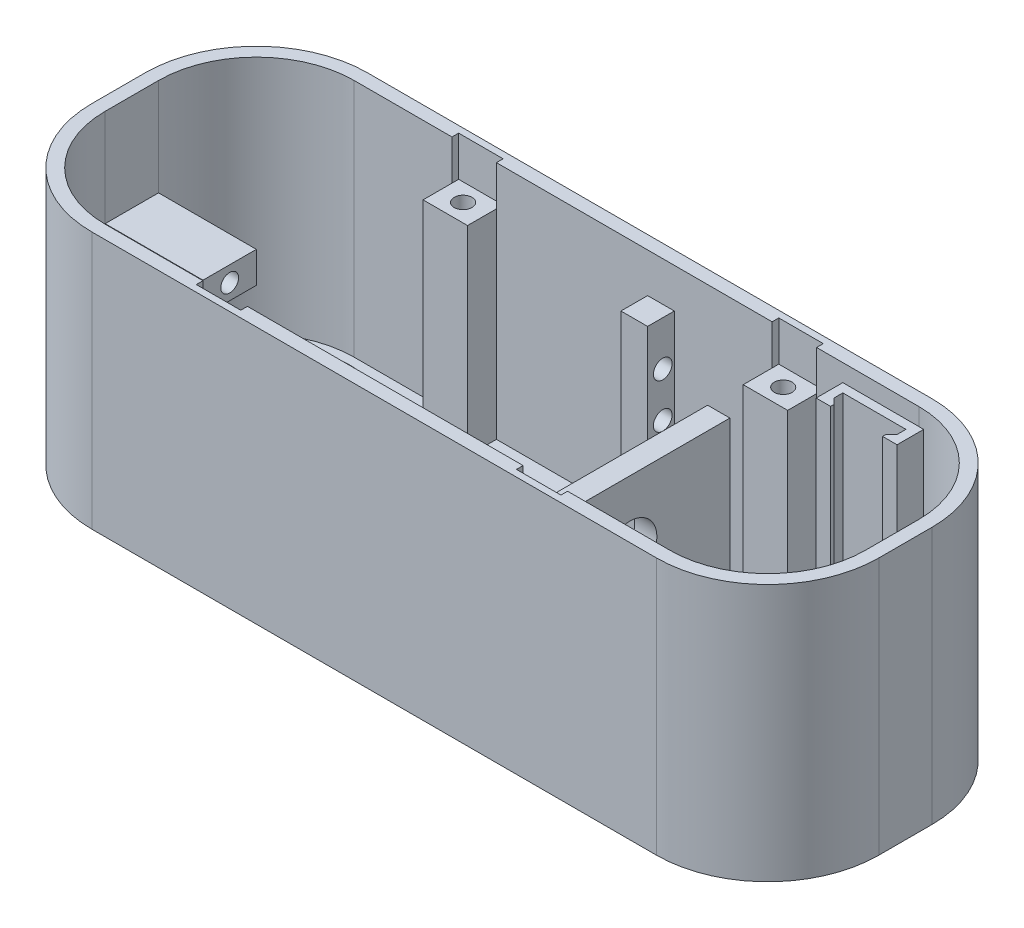
from build123d import *

# Parameters (mm, degrees)
SKETCH1_W            = 177
SKETCH1_H            = 62
BOSS_EXTRUDE1_DEPTH  = 60
FILLET1_R            = 25
SKETCH3_W            = 19
SKETCH3_H            = 17
CUT_EXTRUDE1_DEPTH   = 70
CUT_EXTRUDE5_DEPTH   = 54
SKETCH2_R            = 22
BOSS_EXTRUDE4_DEPTH  = 7
BOSS_EXTRUDE6_DEPTH  = 53
SKETCH11_R           = 20
CUT_EXTRUDE9_DEPTH   = 3.5
SKETCH21_R           = 25
CUT_EXTRUDE10_DEPTH  = 18
SKETCH23_R           = 5
CUT_EXTRUDE11_DEPTH  = 111
SKETCH26_R           = 20
SKETCH26_W           = 19
SKETCH26_H           = 17
BOSS_EXTRUDE23_DEPTH = 1
SKETCH27_W           = 30
SKETCH27_H           = 8
CUT_EXTRUDE12_DEPTH  = 10
SKETCH30_W           = 194.337314874
SKETCH30_H           = 68.122542634
CUT_EXTRUDE14_DEPTH  = 0.1
SKETCH32_R           = 2
CUT_EXTRUDE15_DEPTH  = 20
SKETCH35_W           = 193.893814344
SKETCH35_H           = 68.847857072
CUT_EXTRUDE16_DEPTH  = 3
SKETCH38_W           = 10
SKETCH38_H           = 6.5
SKETCH38_R           = 2
SKETCH38_H_2         = 1.5
BOSS_EXTRUDE26_DEPTH = 53.9
SKETCH39_R           = 2
CUT_EXTRUDE17_DEPTH  = 20
SKETCH38_4_W         = 10
SKETCH38_4_H         = 8
SKETCH38_4_R         = 2
CUT_EXTRUDE22_DEPTH  = 9
SKETCH39_4_W         = 12
SKETCH39_4_H         = 7.011037151
SKETCH39_4_R         = 2
SKETCH39_4_H_2       = 6.988962849
BOSS_EXTRUDE27_DEPTH = 25
SKETCH40_W           = 5
SKETCH40_H           = 35
BOSS_EXTRUDE28_DEPTH = 44.9
CUT_EXTRUDE23_REACH  = 147.748
SKETCH41_R           = 6.075
BOSS_EXTRUDE29_REACH = 193.14
SKETCH44_W           = 6
SKETCH44_H           = 6
SKETCH44_H_2         = 8
BOSS_EXTRUDE30_DEPTH = 45
SKETCH45_R           = 2.1
CUT_EXTRUDE24_DEPTH  = 15
SKETCH46_W           = 20
SKETCH46_H           = 7
CUT_EXTRUDE25_DEPTH  = 10
SKETCH47_W           = 10
SKETCH47_H           = 20
CUT_EXTRUDE26_DEPTH  = 10


with BuildPart() as part:
    # Sketch1 → Boss-Extrude1 (new body)
    with BuildSketch(Plane(origin=(0, 0, 0), x_dir=(1, 0, 0), z_dir=(0, 1, 0))):
        with Locations((88.5, 31)):
            Rectangle(SKETCH1_W, SKETCH1_H)
    extrude(amount=BOSS_EXTRUDE1_DEPTH)

    # Fillet1
    fillet1_edges = [part.edges().sort_by_distance(p)[0] for p in [
        (0, 30, -62),
        (177, 30, -62),
        (177, 30, 0),
        (0, 30, 0),
    ]]
    fillet(fillet1_edges, radius=FILLET1_R)

    # Sketch3 → Cut-Extrude1 (cut)
    with BuildSketch(Plane(origin=(0, 60, 0), x_dir=(1, 0, 0), z_dir=(0, 1, 0))):
        with Locations((147.5, 39.5)):
            Rectangle(SKETCH3_W, SKETCH3_H)
    extrude(amount=-CUT_EXTRUDE1_DEPTH, mode=Mode.SUBTRACT)

    # Sketch9 → Cut-Extrude5 (cut)
    with BuildSketch(Plane(origin=(0, 57, 0), x_dir=(1, 0, 0), z_dir=(0, 1, 0))):
        with BuildLine():
            Line((25, 59), (152, 59))
            ThreePointArc((152, 59), (167.556349186, 52.556349186), (174, 37))
            Line((174, 37), (174, 25))
            ThreePointArc((174, 25), (167.556349186, 9.443650814), (152, 3))
            Line((152, 3), (25, 3))
            ThreePointArc((25, 3), (9.443650814, 9.443650814), (3, 25))
            Line((3, 25), (3, 37))
            ThreePointArc((3, 37), (9.443650814, 52.556349186), (25, 59))
        make_face()
    extrude(amount=-CUT_EXTRUDE5_DEPTH, mode=Mode.SUBTRACT)

    # Sketch2 → Boss-Extrude4 (add)
    with BuildSketch(Plane.XZ):
        with Locations(Location((30, -31, 0), (0, 0, 270))):
            Circle(SKETCH2_R)
    extrude(amount=-BOSS_EXTRUDE4_DEPTH)

    # Sketch14 → Boss-Extrude6 (add)
    with BuildSketch(Plane.XZ):
        Polygon((136.9, -55), (138.15, -53.75), (138.15, -53), (134.9, -53), (134.9, -55), (134.9, -62), (137.25, -62), (150.75, -62), (153.1, -62), (153.1, -55), (153.1, -53), (149.85, -53), (149.85, -53.75), (151.1, -55), (151.1, -57), (136.9, -57), align=None)
    extrude(amount=-BOSS_EXTRUDE6_DEPTH)

    # Sketch11 → Cut-Extrude9 (cut)
    with BuildSketch(Plane.XZ):
        with Locations(Location((31, -31, 0), (0, 0, 270))):
            Circle(SKETCH11_R)
    extrude(amount=-CUT_EXTRUDE9_DEPTH, mode=Mode.SUBTRACT)

    # Sketch21 → Cut-Extrude10 (cut)
    with BuildSketch(Plane(origin=(0, 60, 0), x_dir=(1, 0, 0), z_dir=(0, 1, 0))):
        with Locations(Location((31, 31, 0), (0, 0, 270))):
            Circle(SKETCH21_R)
    extrude(amount=-CUT_EXTRUDE10_DEPTH, mode=Mode.SUBTRACT)

    # Sketch23 → Cut-Extrude11 (cut)
    with BuildSketch(Plane(origin=(0, 60, 0), x_dir=(1, 0, 0), z_dir=(0, 1, 0))):
        with Locations(Location((31, 31, 0), (0, 0, 270))):
            Circle(SKETCH23_R)
    extrude(amount=-CUT_EXTRUDE11_DEPTH, mode=Mode.SUBTRACT)

    # Sketch26 → Boss-Extrude23 (add)
    with BuildSketch(Plane.XZ):
        with BuildLine():
            Line((25, 0), (152, 0))
            ThreePointArc((152, 0), (169.67766953, -7.32233047), (177, -25))
            Line((177, -25), (177, -37))
            ThreePointArc((177, -37), (169.67766953, -54.67766953), (152, -62))
            Line((152, -62), (25, -62))
            ThreePointArc((25, -62), (7.32233047, -54.67766953), (0, -37))
            Line((0, -37), (0, -25))
            ThreePointArc((0, -25), (7.32233047, -7.32233047), (25, 0))
        make_face()
        with Locations(Location((31, -31, 0), (0, 0, 270))):
            Circle(SKETCH26_R, mode=Mode.SUBTRACT)
        with Locations((147.5, -39.5)):
            Rectangle(SKETCH26_W, SKETCH26_H, mode=Mode.SUBTRACT)
    extrude(amount=BOSS_EXTRUDE23_DEPTH)

    # Sketch27 → Cut-Extrude12 (cut)
    with BuildSketch(Plane.ZY):
        with Locations((-31, 24)):
            Rectangle(SKETCH27_W, SKETCH27_H)
    extrude(amount=-CUT_EXTRUDE12_DEPTH, mode=Mode.SUBTRACT)

    # Sketch30 → Cut-Extrude14 (cut)
    with BuildSketch(Plane(origin=(0, 57, 0), x_dir=(1, 0, 0), z_dir=(0, 1, 0))):
        with Locations((88.376869027, 31.076383763)):
            Rectangle(SKETCH30_W, SKETCH30_H)
        with BuildLine():
            Line((25, 58), (152, 58))
            ThreePointArc((152, 58), (166.849242405, 51.849242405), (173, 37))
            Line((173, 37), (173, 25))
            ThreePointArc((173, 25), (166.849242405, 10.150757595), (152, 4))
            Line((152, 4), (25, 4))
            ThreePointArc((25, 4), (10.150757595, 10.150757595), (4, 25))
            Line((4, 25), (4, 37))
            ThreePointArc((4, 37), (10.150757595, 51.849242405), (25, 58))
        make_face(mode=Mode.SUBTRACT)
    extrude(amount=-CUT_EXTRUDE14_DEPTH, mode=Mode.SUBTRACT)


with BuildPart() as cut_extrude14_piece_1:
    # of the separate pieces the step leaves, piece 1, a body of its own (cut_extrude14_pieces)
    add(part.part.solids().sort_by_distance((25, 56.9, 0))[0])

    # Sketch38 → Boss-Extrude26 (add)
    # profile 1 of 8: a face of its own
    with BuildSketch(Plane(origin=(0, 56.9, 0), x_dir=(1, 0, 0), z_dir=(0, 1, 0))):
        with Locations((52, 6.25)):
            Rectangle(SKETCH38_W, SKETCH38_H)
        with Locations(Location((52, 5.5, 0), (0, 0, 270))):
            Circle(SKETCH38_R, mode=Mode.SUBTRACT)
    # profile 2 of 8: a face of its own
    with BuildSketch(Plane(origin=(0, 56.9, 0), x_dir=(1, 0, 0), z_dir=(0, 1, 0))):
        with Locations((52, 2.25)):
            Rectangle(SKETCH38_W, SKETCH38_H_2)
    # profile 3 of 8: a face of its own
    with BuildSketch(Plane(origin=(0, 56.9, 0), x_dir=(1, 0, 0), z_dir=(0, 1, 0))):
        with Locations((52, 59.75)):
            Rectangle(SKETCH38_W, SKETCH38_H_2)
    # profile 4 of 8: a face of its own
    with BuildSketch(Plane(origin=(0, 56.9, 0), x_dir=(1, 0, 0), z_dir=(0, 1, 0))):
        with Locations((52, 55.75)):
            Rectangle(SKETCH38_W, SKETCH38_H)
        with Locations(Location((52, 56.5, 0), (0, 0, 270))):
            Circle(SKETCH38_R, mode=Mode.SUBTRACT)
    # profile 5 of 8: a face of its own
    with BuildSketch(Plane(origin=(0, 56.9, 0), x_dir=(1, 0, 0), z_dir=(0, 1, 0))):
        with Locations((124, 55.75)):
            Rectangle(SKETCH38_W, SKETCH38_H)
        with Locations(Location((124, 56.5, 0), (0, 0, 270))):
            Circle(SKETCH38_R, mode=Mode.SUBTRACT)
    # profile 6 of 8: a face of its own
    with BuildSketch(Plane(origin=(0, 56.9, 0), x_dir=(1, 0, 0), z_dir=(0, 1, 0))):
        with Locations((124, 59.75)):
            Rectangle(SKETCH38_W, SKETCH38_H_2)
    # profile 7 of 8: a face of its own
    with BuildSketch(Plane(origin=(0, 56.9, 0), x_dir=(1, 0, 0), z_dir=(0, 1, 0))):
        with Locations((124, 6.25)):
            Rectangle(SKETCH38_W, SKETCH38_H)
        with Locations(Location((124, 5.5, 0), (0, 0, 270))):
            Circle(SKETCH38_R, mode=Mode.SUBTRACT)
    # profile 8 of 8: a face of its own
    with BuildSketch(Plane(origin=(0, 56.9, 0), x_dir=(1, 0, 0), z_dir=(0, 1, 0))):
        with Locations((124, 2.25)):
            Rectangle(SKETCH38_W, SKETCH38_H_2)
    extrude(amount=-BOSS_EXTRUDE26_DEPTH)

    # Sketch39 → Cut-Extrude17 (cut)
    with BuildSketch(Plane.ZY):
        with Locations((-31, 31.505518576)):
            Circle(SKETCH39_R)
        with Locations((-31, 16.505518576)):
            Circle(SKETCH39_R)
    extrude(amount=-CUT_EXTRUDE17_DEPTH, mode=Mode.SUBTRACT)

    # Sketch38<4> → Cut-Extrude22 (cut)
    # profile 1 of 4: a face of its own
    with BuildSketch(Plane(origin=(0, 56.9, 0), x_dir=(1, 0, 0), z_dir=(0, 1, 0))):
        with Locations((52, 56.5)):
            Rectangle(SKETCH38_4_W, SKETCH38_4_H)
        with Locations(Location((52, 56.5, 0), (0, 0, 270))):
            Circle(SKETCH38_4_R, mode=Mode.SUBTRACT)
    # profile 2 of 4: a face of its own
    with BuildSketch(Plane(origin=(0, 56.9, 0), x_dir=(1, 0, 0), z_dir=(0, 1, 0))):
        with Locations((124, 56.5)):
            Rectangle(SKETCH38_4_W, SKETCH38_4_H)
        with Locations(Location((124, 56.5, 0), (0, 0, 270))):
            Circle(SKETCH38_4_R, mode=Mode.SUBTRACT)
    # profile 3 of 4: a face of its own
    with BuildSketch(Plane(origin=(0, 56.9, 0), x_dir=(1, 0, 0), z_dir=(0, 1, 0))):
        with Locations((52, 5.5)):
            Rectangle(SKETCH38_4_W, SKETCH38_4_H)
        with Locations(Location((52, 5.5, 0), (0, 0, 270))):
            Circle(SKETCH38_4_R, mode=Mode.SUBTRACT)
    # profile 4 of 4: a face of its own
    with BuildSketch(Plane(origin=(0, 56.9, 0), x_dir=(1, 0, 0), z_dir=(0, 1, 0))):
        with Locations((124, 5.5)):
            Rectangle(SKETCH38_4_W, SKETCH38_4_H)
        with Locations(Location((124, 5.5, 0), (0, 0, 270))):
            Circle(SKETCH38_4_R, mode=Mode.SUBTRACT)
    extrude(amount=-CUT_EXTRUDE22_DEPTH, mode=Mode.SUBTRACT)

    # Sketch39<4> → Boss-Extrude27 (add)
    # profile 1 of 2: a face of its own
    with BuildSketch(Plane.ZY):
        with Locations((-31, 31.505518576)):
            Rectangle(SKETCH39_4_W, SKETCH39_4_H)
        with Locations((-31, 31.505518576)):
            Circle(SKETCH39_4_R, mode=Mode.SUBTRACT)
    # profile 2 of 2: a face of its own
    with BuildSketch(Plane.ZY):
        with Locations((-31, 16.505518575)):
            Rectangle(SKETCH39_4_W, SKETCH39_4_H_2)
        with Locations((-31, 16.505518576)):
            Circle(SKETCH39_4_R, mode=Mode.SUBTRACT)
    extrude(amount=-BOSS_EXTRUDE27_DEPTH)

    # Sketch40 → Boss-Extrude28 (add)
    with BuildSketch(Plane(origin=(0, 3, 0), x_dir=(1, 0, 0), z_dir=(0, 1, 0))):
        with Locations((121.5, 27)):
            Rectangle(SKETCH40_W, SKETCH40_H)
    extrude(amount=BOSS_EXTRUDE28_DEPTH)

    # Sketch41 → Cut-Extrude23 (cut, up to next)
    with BuildSketch(Plane.ZY.offset(-119), mode=Mode.PRIVATE) as cut_extrude23_sk1:
        with Locations((-22, 33)):
            Circle(SKETCH41_R)
    cut_extrude23_tool1 = extrude(cut_extrude23_sk1.sketch, amount=-CUT_EXTRUDE23_REACH, mode=Mode.PRIVATE) & cut_extrude14_piece_1.part
    add(cut_extrude23_tool1.solids().sort_by_distance((119, 33, -22))[0], mode=Mode.SUBTRACT)

    # Sketch43 → Boss-Extrude29 (add, up to next)
    with BuildSketch(Plane(origin=(0, 20, 0), x_dir=(1, 0, 0), z_dir=(0, 1, 0)), mode=Mode.PRIVATE) as boss_extrude29_sk1:
        with BuildLine():
            Line((0, 25), (0, 37))
            ThreePointArc((0, 37), (0.422620263, 41.577379737), (1.676192421, 46))
            Line((1.676192421, 46), (4.9251401, 46))
            ThreePointArc((4.9251401, 46), (3.48666788, 41.601797595), (3, 37))
            Line((3, 37), (3, 25))
            ThreePointArc((3, 25), (3.48666788, 20.398202405), (4.9251401, 16))
            Line((4.9251401, 16), (1.676192421, 16))
            ThreePointArc((1.676192421, 16), (0.422620263, 20.422620263), (0, 25))
        make_face()
    boss_extrude29_tool1 = extrude(boss_extrude29_sk1.sketch, amount=BOSS_EXTRUDE29_REACH, mode=Mode.PRIVATE) - cut_extrude14_piece_1.part
    add(boss_extrude29_tool1.solids().sort_by_distance((1.865651, 20, -31))[0])

    # Sketch44 → Boss-Extrude30 (add)
    with BuildSketch(Plane(origin=(0, 3, 0), x_dir=(1, 0, 0), z_dir=(0, 1, 0))):
        with Locations((94, 56)):
            Rectangle(SKETCH44_W, SKETCH44_H)
        with Locations((94, 7)):
            Rectangle(SKETCH44_W, SKETCH44_H_2)
    extrude(amount=BOSS_EXTRUDE30_DEPTH)

    # Sketch45 → Cut-Extrude24 (cut)
    with BuildSketch(Plane(origin=(97, 0, 0), x_dir=(0, 0, -1), z_dir=(1, 0, 0))):
        with Locations((7.6, 38)):
            Circle(SKETCH45_R)
        with Locations((7.6, 28)):
            Circle(SKETCH45_R)
        with Locations((56.4, 38)):
            Circle(SKETCH45_R)
        with Locations((56.4, 28)):
            Circle(SKETCH45_R)
    extrude(amount=-CUT_EXTRUDE24_DEPTH, mode=Mode.SUBTRACT)

    # Sketch46 → Cut-Extrude25 (cut)
    with BuildSketch(Plane.ZY):
        with Locations((-31, 24.005518576)):
            Rectangle(SKETCH46_W, SKETCH46_H)
    extrude(amount=-CUT_EXTRUDE25_DEPTH, mode=Mode.SUBTRACT)

    # Sketch47 → Cut-Extrude26 (cut)
    with BuildSketch(Plane(origin=(0, 3, 0), x_dir=(1, 0, 0), z_dir=(0, 1, 0))):
        with Locations((104, 31)):
            Rectangle(SKETCH47_W, SKETCH47_H)
    extrude(amount=-CUT_EXTRUDE26_DEPTH, mode=Mode.SUBTRACT)


with BuildPart() as cut_extrude14_piece_2:
    # of the separate pieces the step leaves, piece 2, a body of its own (cut_extrude14_pieces)
    add(part.part.solids().sort_by_distance((25, 60, 0))[0])

    # Sketch32 → Cut-Extrude15 (cut)
    with BuildSketch(Plane(origin=(0, 60, 0), x_dir=(1, 0, 0), z_dir=(0, 1, 0))):
        with Locations(Location((52, 5.5, 0), (0, 0, 270))):
            Circle(SKETCH32_R)
        with Locations(Location((52, 56.5, 0), (0, 0, 270))):
            Circle(SKETCH32_R)
        with Locations(Location((164.556349186, 10, 0), (0, 0, 270))):
            Circle(SKETCH32_R)
        with Locations(Location((124, 56.5, 0), (0, 0, 270))):
            Circle(SKETCH32_R)
    extrude(amount=-CUT_EXTRUDE15_DEPTH, mode=Mode.SUBTRACT)

    # Sketch35 → Cut-Extrude16 (cut)
    with BuildSketch(Plane(origin=(0, 60, 0), x_dir=(1, 0, 0), z_dir=(0, 1, 0))):
        with Locations((88.811059595, 30.688940405)):
            Rectangle(SKETCH35_W, SKETCH35_H)
    extrude(amount=-CUT_EXTRUDE16_DEPTH, mode=Mode.SUBTRACT)


solid = cut_extrude14_piece_1.part
